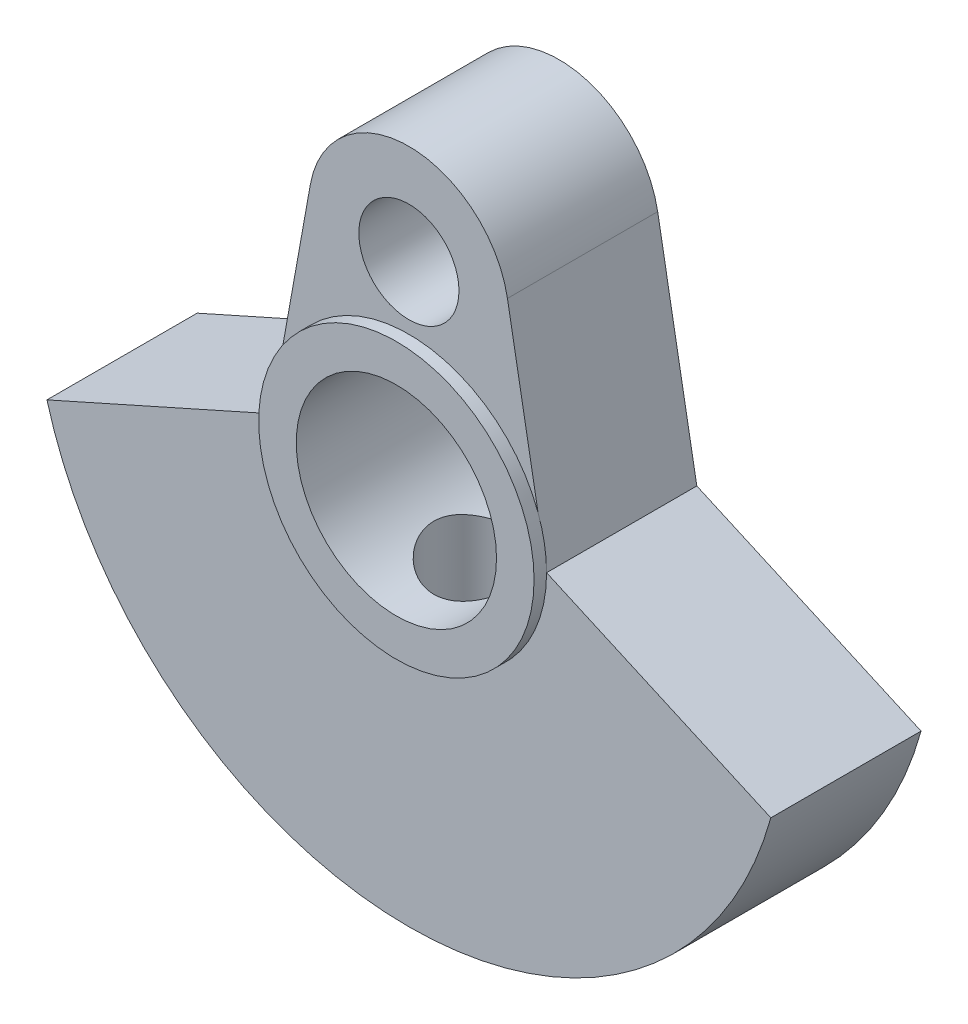
from build123d import *

# Parameters (mm, degrees)
SKETCH1_R                           = 2
SKETCH1_R_2                         = 4
BOSS_EXTRUDE1_DEPTH                 = 6
SKETCH2_R                           = 5.5
SKETCH2_R_2                         = 4
BOSS_EXTRUDE2_DEPTH                 = 0.5
CUT_EXTRUDE1_REACH                  = 28.823
CUT_EXTRUDE1_END_RADIUS             = 15
CUT_EXTRUDE1_START                  = -5
SKETCH3_R                           = 2
CUT_EXTRUDE1_DIRECTION_2_REACH      = 28.823
CUT_EXTRUDE1_DIRECTION_2_END_RADIUS = 4


with BuildPart() as part:
    # Sketch1 → Boss-Extrude1 (new body)
    with BuildSketch(Plane.XY):
        with BuildLine():
            Line((5.5, 0), (14.456832295, -4))
            ThreePointArc((14.456832295, -4), (0, -15), (-14.456832295, -4))
            Line((-14.456832295, -4), (-5.5, 0))
            Line((-5.5, 0), (-3.937070517, 8.70673598))
            ThreePointArc((-3.937070517, 8.70673598), (0, 12), (3.937070517, 8.70673598))
            Line((3.937070517, 8.70673598), (5.5, 0))
        make_face()
        with Locations((0, 8)):
            Circle(SKETCH1_R, mode=Mode.SUBTRACT)
        Circle(SKETCH1_R_2, mode=Mode.SUBTRACT)
    extrude(amount=BOSS_EXTRUDE1_DEPTH)

    # Sketch2 → Boss-Extrude2 (add)
    with BuildSketch(Plane.XY.offset(6)):
        Circle(SKETCH2_R)
        Circle(SKETCH2_R_2, mode=Mode.SUBTRACT)
    extrude(amount=BOSS_EXTRUDE2_DEPTH)

    # Cut-Extrude1: up to this cylinder (the profile starts inside it)
    cut_extrude1_end = Plane(origin=(0, 0, 3), z_dir=(0, 0, -1)) * Cylinder(CUT_EXTRUDE1_END_RADIUS, 88.646, mode=Mode.PRIVATE)
    # Sketch3 → Cut-Extrude1 (cut, up to the surface)
    with BuildSketch(Plane(origin=(0, 0, 0), x_dir=(1, 0, 0), z_dir=(0, 1, 0)).offset(CUT_EXTRUDE1_START), mode=Mode.PRIVATE) as cut_extrude1_sk1:
        with Locations(Location((0, -3, 0), (0, 0, 270))):
            Circle(SKETCH3_R)
    cut_extrude1_tool1 = extrude(cut_extrude1_sk1.sketch, amount=-CUT_EXTRUDE1_REACH, mode=Mode.PRIVATE) & cut_extrude1_end
    add(cut_extrude1_tool1.solids().sort_by_distance((0, -5, 3))[0], mode=Mode.SUBTRACT)

    # Cut-Extrude1 direction 2: up to this cylinder (the profile starts outside it)
    cut_extrude1_direction_2_end = Plane(origin=(0, 0, 3), z_dir=(0, 0, -1)) * Cylinder(CUT_EXTRUDE1_DIRECTION_2_END_RADIUS, 66.646, mode=Mode.PRIVATE)
    # Sketch3 → Cut-Extrude1 direction 2 (cut, up to the surface)
    with BuildSketch(Plane(origin=(0, 0, 0), x_dir=(1, 0, 0), z_dir=(0, 1, 0)).offset(CUT_EXTRUDE1_START), mode=Mode.PRIVATE) as cut_extrude1_direction_2_sk1:
        with Locations(Location((0, -3, 0), (0, 0, 270))):
            Circle(SKETCH3_R)
    cut_extrude1_direction_2_tool1 = extrude(cut_extrude1_direction_2_sk1.sketch, amount=CUT_EXTRUDE1_DIRECTION_2_REACH, mode=Mode.PRIVATE) - cut_extrude1_direction_2_end
    add(cut_extrude1_direction_2_tool1.solids().sort_by_distance((0, -5, 3))[0], mode=Mode.SUBTRACT)


solid = part.part
